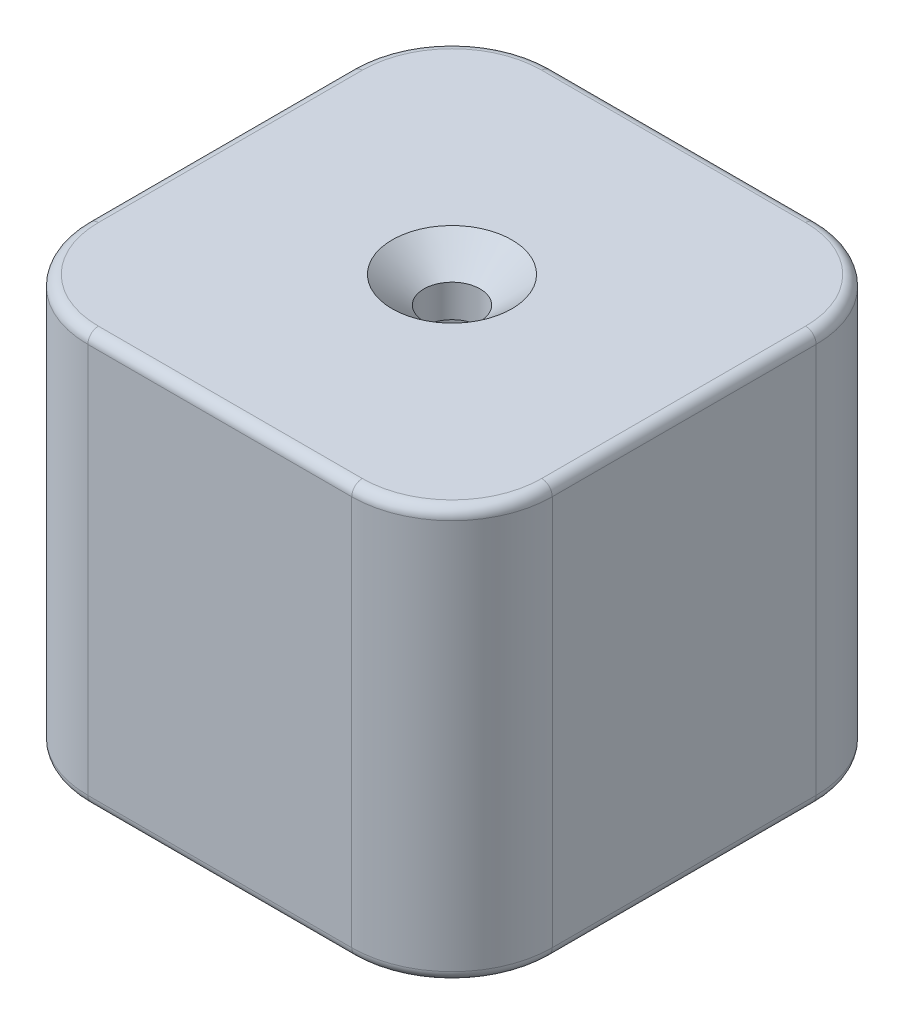
from build123d import *

# Parameters (mm, degrees)
BOSS_EXTRUDE1_DEPTH                                 = 6.35
BOSS_EXTRUDE1_DEPTH_BACK                            = 0.762
BOSS_EXTRUDE2_DEPTH                                 = 42.418
CSK_FOR_1_4_FLAT_HEAD_MACHINE_SCREW_100_D           = 6.7564
CSK_FOR_1_4_FLAT_HEAD_MACHINE_SCREW_100_CSINK_D     = 14.3913352
CSK_FOR_1_4_FLAT_HEAD_MACHINE_SCREW_100_CSINK_ANGLE = 100
FILLET1_R                                           = 1.27
CHAMFER1_SIZE                                       = 1.27
FILLET2_R                                           = 1.27


with BuildPart() as part:
    # Sketch2 → Boss-Extrude1 (new, two sides: drawn at the far end of the back side and taken through both)
    with BuildSketch(Plane(origin=(0, 43.18, 0), x_dir=(1, 0, 0), z_dir=(0, 1, 0)).offset(-BOSS_EXTRUDE1_DEPTH_BACK)):
        with BuildLine():
            Line((-27.94, 15.875), (-27.94, -15.875))
            ThreePointArc((-27.94, -15.875), (-24.406243315, -24.406243315), (-15.875, -27.94))
            Line((-15.875, -27.94), (15.875, -27.94))
            ThreePointArc((15.875, -27.94), (24.406243315, -24.406243315), (27.94, -15.875))
            Line((27.94, -15.875), (27.94, 15.875))
            ThreePointArc((27.94, 15.875), (24.406243315, 24.406243315), (15.875, 27.94))
            Line((15.875, 27.94), (-15.875, 27.94))
            ThreePointArc((-15.875, 27.94), (-24.406243315, 24.406243315), (-27.94, 15.875))
        make_face()
    extrude(amount=BOSS_EXTRUDE1_DEPTH + BOSS_EXTRUDE1_DEPTH_BACK)

    # Sketch1 → Boss-Extrude2 (add)
    with BuildSketch(Plane(origin=(0, 0, 0), x_dir=(1, 0, 0), z_dir=(0, 1, 0))):
        with BuildLine():
            Line((-27.94, -15.875), (-27.94, 15.875))
            ThreePointArc((-27.94, 15.875), (-24.406243315, 24.406243315), (-15.875, 27.94))
            Line((-15.875, 27.94), (15.875, 27.94))
            ThreePointArc((15.875, 27.94), (24.406243315, 24.406243315), (27.94, 15.875))
            Line((27.94, 15.875), (27.94, -15.875))
            ThreePointArc((27.94, -15.875), (24.406243315, -24.406243315), (15.875, -27.94))
            Line((15.875, -27.94), (-15.875, -27.94))
            ThreePointArc((-15.875, -27.94), (-24.406243315, -24.406243315), (-27.94, -15.875))
        make_face()
        with BuildLine():
            Line((-22.86, -15.875), (-22.86, 15.875))
            ThreePointArc((-22.86, 15.875), (-20.814140867, 20.814140867), (-15.875, 22.86))
            Line((-15.875, 22.86), (15.875, 22.86))
            ThreePointArc((15.875, 22.86), (20.814140867, 20.814140867), (22.86, 15.875))
            Line((22.86, 15.875), (22.86, -15.875))
            ThreePointArc((22.86, -15.875), (20.814140867, -20.814140867), (15.875, -22.86))
            Line((15.875, -22.86), (-15.875, -22.86))
            ThreePointArc((-15.875, -22.86), (-20.814140867, -20.814140867), (-22.86, -15.875))
        make_face(mode=Mode.SUBTRACT)
    extrude(amount=BOSS_EXTRUDE2_DEPTH)

    # CSK for 1/4 Flat Head Machine Screw (100)1 (through all)
    with Locations(Plane(origin=(0, 49.53, 0), x_dir=(1, 0, 0), z_dir=(0, 1, 0))):
        with Locations((0, 0)):
            CounterSinkHole(CSK_FOR_1_4_FLAT_HEAD_MACHINE_SCREW_100_D / 2, CSK_FOR_1_4_FLAT_HEAD_MACHINE_SCREW_100_CSINK_D / 2, counter_sink_angle=CSK_FOR_1_4_FLAT_HEAD_MACHINE_SCREW_100_CSINK_ANGLE)

    # Fillet1
    fillet1_edges = [part.edges().sort_by_distance(p)[0] for p in [
        (24.406243315, 49.53, 24.406243315),
        (27.94, 49.53, 0),
        (24.406243315, 49.53, -24.406243315),
        (0, 49.53, -27.94),
        (-24.406243315, 49.53, -24.406243315),
        (-27.94, 49.53, 0),
        (-24.406243315, 49.53, 24.406243315),
        (0, 49.53, 27.94),
    ]]
    fillet(fillet1_edges, radius=FILLET1_R)

    # Chamfer1
    chamfer1_edges = [part.edges().sort_by_distance(p)[0] for p in [
        (-22.86, 0, 0),
        (-20.814140867, 0, 20.814140867),
        (0, 0, 22.86),
        (20.814140867, 0, 20.814140867),
        (22.86, 0, 0),
        (20.814140867, 0, -20.814140867),
        (0, 0, -22.86),
        (-20.814140867, 0, -20.814140867),
    ]]
    chamfer(chamfer1_edges, length=CHAMFER1_SIZE)

    # Fillet2
    fillet2_edges = [part.edges().sort_by_distance(p)[0] for p in [
        (-27.94, 0, 0),
        (-24.406243315, 0, -24.406243315),
        (0, 0, -27.94),
        (24.406243315, 0, -24.406243315),
        (27.94, 0, 0),
        (24.406243315, 0, 24.406243315),
        (0, 0, 27.94),
        (-24.406243315, 0, 24.406243315),
    ]]
    fillet(fillet2_edges, radius=FILLET2_R)


solid = part.part
